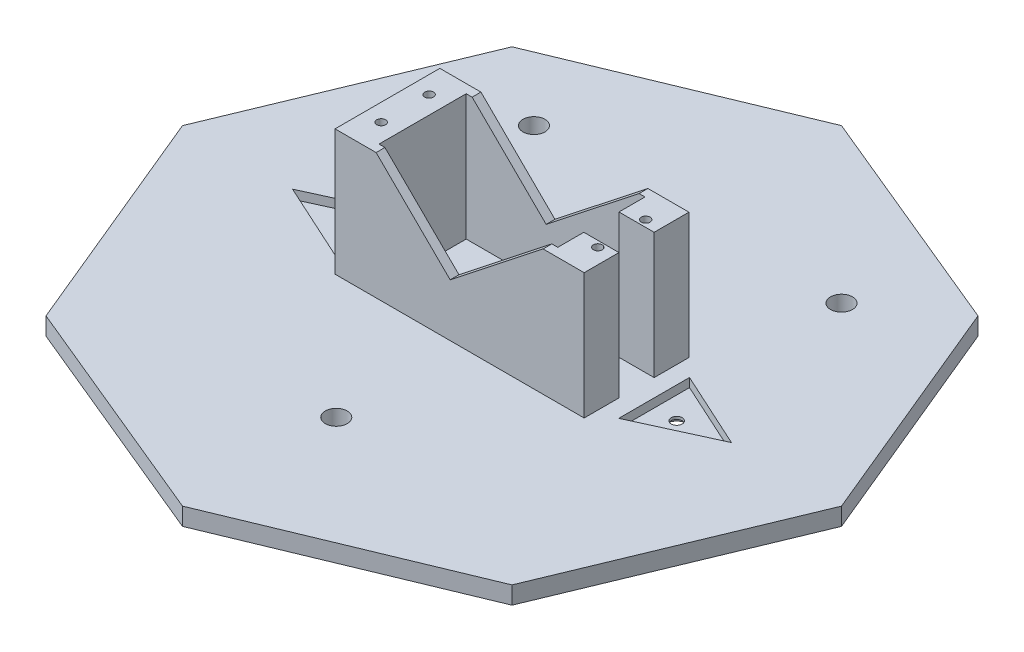
from build123d import *

# Parameters (mm, degrees)
AUFSATZ_LINEAR_AUSTRAGEN1_DEPTH      = 3
AUFSATZ_LINEAR_AUSTRAGEN1_DEPTH_BACK = 1
AUFSATZ_LINEAR_AUSTRAGEN3_DEPTH      = 31.65
SCHNITT_LINEAR_AUSTRAGEN1_DEPTH      = 28.65
SKIZZE7_R                            = 2.5
SCHNITT_LINEAR_AUSTRAGEN2_DEPTH      = 110.867294952
SCHNITT_LINEAR_AUSTRAGEN6_DEPTH      = 2
SKIZZE9_R                            = 1
SCHNITT_LINEAR_AUSTRAGEN5_DEPTH      = 13.1
SKIZZE10_R                           = 1.25
SCHNITT_LINEAR_AUSTRAGEN7_DEPTH      = 111.405717696
SKIZZE11_R                           = 2.75
SCHNITT_LINEAR_AUSTRAGEN8_DEPTH      = 1.4


with BuildPart() as part:
    # Skizze2 → Aufsatz-Linear austragen1 (new, two sides: drawn at the far end of the back side and taken through both)
    with BuildSketch(Plane(origin=(0, 0, 0), x_dir=(1, 0, 0), z_dir=(0, 1, 0)).offset(-AUFSATZ_LINEAR_AUSTRAGEN1_DEPTH_BACK)):
        Polygon((-53.033008589, 53.033008589), (0, 0), (53.033008589, 53.033008589), (0, 75), align=None)
        Polygon((53.033008589, 53.033008589), (0, 0), (75, 0), align=None)
        Polygon((75, 0), (0, 0), (53.033008589, -53.033008589), align=None)
        Polygon((53.033008589, -53.033008589), (0, 0), (-53.033008589, -53.033008589), (0, -75), align=None)
        Polygon((-53.033008589, 53.033008589), (-75, 0), (0, 0), align=None)
        Polygon((0, 0), (-75, 0), (-53.033008589, -53.033008589), align=None)
    extrude(amount=AUFSATZ_LINEAR_AUSTRAGEN1_DEPTH + AUFSATZ_LINEAR_AUSTRAGEN1_DEPTH_BACK)

    # Skizze5 → Aufsatz-Linear austragen3 (add)
    with BuildSketch(Plane(origin=(0, 0, 0), x_dir=(1, 0, 0), z_dir=(0, 1, 0))):
        Polygon((20.35, -4), (28.35, -4), (28.35, -11.925), (-28.35, -11.925), (-28.35, 11.925), (28.35, 11.925), (28.35, 4), (20.35, 4), (20.35, 9.925), (-20.35, 9.925), (-20.35, -9.925), (20.35, -9.925), align=None)
    extrude(amount=AUFSATZ_LINEAR_AUSTRAGEN3_DEPTH)

    # Skizze6 → Schnitt-Linear austragen1 (cut)
    with BuildSketch(Plane.XY.offset(11.925)):
        Polygon((-19, 31.65), (19, 31.65), (-2.152730863, 14.994542406), align=None)
    extrude(amount=-SCHNITT_LINEAR_AUSTRAGEN1_DEPTH, mode=Mode.SUBTRACT)

    # Skizze7 → Schnitt-Linear austragen2 (cut, through all)
    with BuildSketch(Plane(origin=(0, 3, 0), x_dir=(1, 0, 0), z_dir=(0, 1, 0))):
        with Locations(Location((35, 40, 0), (0, 0, 270))):
            Circle(SKIZZE7_R)
        with Locations(Location((-35, 40, 0), (0, 0, 270))):
            Circle(SKIZZE7_R)
        with Locations(Location((0, -40, 0), (0, 0, 270))):
            Circle(SKIZZE7_R)
    extrude(amount=-SCHNITT_LINEAR_AUSTRAGEN2_DEPTH, mode=Mode.SUBTRACT)

    # Skizze8 → Schnitt-Linear austragen6 (cut)
    with BuildSketch(Plane(origin=(0, 3, 0), x_dir=(1, 0, 0), z_dir=(0, 1, 0))):
        Polygon((-32.35, 8.05), (-32.35, -8.05), (-49.95, 0), align=None)
        Polygon((32.35, -8.05), (49.95, 0), (32.35, 8.05), align=None)
    extrude(amount=-SCHNITT_LINEAR_AUSTRAGEN6_DEPTH, mode=Mode.SUBTRACT)

    # Skizze9 → Schnitt-Linear austragen5 (cut)
    with BuildSketch(Plane(origin=(0, 31.65, 0), x_dir=(1, 0, 0), z_dir=(0, 1, 0))):
        with Locations(Location((-24.4, -5.375, 0), (0, 0, 270))):
            Circle(SKIZZE9_R)
        with Locations(Location((-24.4, 5.525, 0), (0, 0, 270))):
            Circle(SKIZZE9_R)
        with Locations(Location((24.9, 5.525, 0), (0, 0, 270))):
            Circle(SKIZZE9_R)
        with Locations(Location((24.9, -5.375, 0), (0, 0, 270))):
            Circle(SKIZZE9_R)
    extrude(amount=-SCHNITT_LINEAR_AUSTRAGEN5_DEPTH, mode=Mode.SUBTRACT)

    # Skizze10 → Schnitt-Linear austragen7 (cut, through all)
    with BuildSketch(Plane(origin=(0, 1, 0), x_dir=(1, 0, 0), z_dir=(0, 1, 0))):
        with Locations(Location((-37.437800905, 0, 0), (0, 0, 270))):
            Circle(SKIZZE10_R)
        with Locations(Location((37.44, 0.05, 0), (0, 0, 90))):
            Circle(SKIZZE10_R)
    extrude(amount=-SCHNITT_LINEAR_AUSTRAGEN7_DEPTH, mode=Mode.SUBTRACT)

    # Skizze11 → Schnitt-Linear austragen8 (cut)
    with BuildSketch(Plane.XZ.offset(1)):
        with Locations(Location((-37.437800905, 0, 0), (0, 0, 270))):
            Circle(SKIZZE11_R)
        with Locations(Location((37.44, -0.05, 0), (0, 0, 270))):
            Circle(SKIZZE11_R)
    extrude(amount=-SCHNITT_LINEAR_AUSTRAGEN8_DEPTH, mode=Mode.SUBTRACT)


solid = part.part
